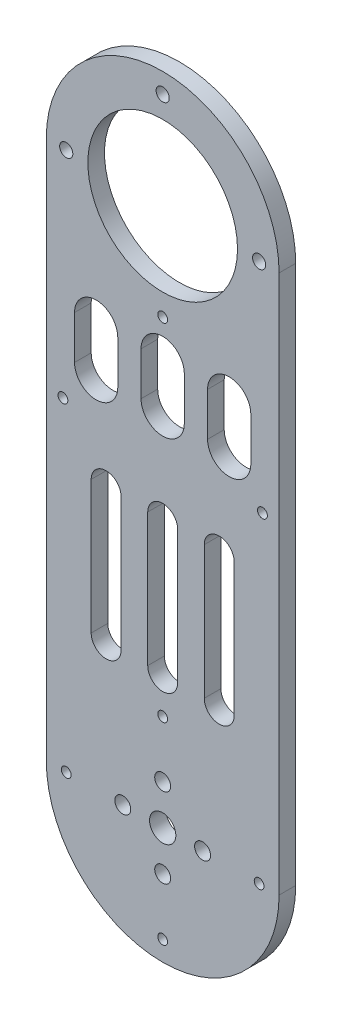
from build123d import *

# Parameters (mm, degrees)
SKETCH1_R           = 3.95
SKETCH1_R_2         = 1.475
SKETCH1_R_3         = 22.5
SKETCH1_R_4         = 2.4
SKETCH1_R_5         = 1.975
BOSS_EXTRUDE1_DEPTH = 5


with BuildPart() as part:
    # Sketch1 → Boss-Extrude1 (new body)
    with BuildSketch(Plane.XY):
        with BuildLine():
            Line((35, 0), (35, 162))
            ThreePointArc((35, 162), (0, 197), (-35, 162))
            Line((-35, 162), (-35, 0))
            ThreePointArc((-35, 0), (0, -35), (35, 0))
        make_face()
        Circle(SKETCH1_R, mode=Mode.SUBTRACT)
        with Locations((0, 29)):
            Circle(SKETCH1_R_2, mode=Mode.SUBTRACT)
        with Locations((0, 162)):
            Circle(SKETCH1_R_3, mode=Mode.SUBTRACT)
        with Locations((0, 133)):
            Circle(SKETCH1_R_2, mode=Mode.SUBTRACT)
        with Locations((-30, 97)):
            Circle(SKETCH1_R_2, mode=Mode.SUBTRACT)
        with Locations(Location((30, 97, 0), (0, 0, 180))):
            Circle(SKETCH1_R_2, mode=Mode.SUBTRACT)
        with Locations((29, 0)):
            Circle(SKETCH1_R_2, mode=Mode.SUBTRACT)
        with Locations((0, -29)):
            Circle(SKETCH1_R_2, mode=Mode.SUBTRACT)
        with Locations((-29, 0)):
            Circle(SKETCH1_R_2, mode=Mode.SUBTRACT)
        with Locations((0, 12)):
            Circle(SKETCH1_R_4, mode=Mode.SUBTRACT)
        with Locations((12, 0)):
            Circle(SKETCH1_R_4, mode=Mode.SUBTRACT)
        with Locations((0, -12)):
            Circle(SKETCH1_R_4, mode=Mode.SUBTRACT)
        with Locations((-12, 0)):
            Circle(SKETCH1_R_4, mode=Mode.SUBTRACT)
        with Locations((0, 191)):
            Circle(SKETCH1_R_5, mode=Mode.SUBTRACT)
        with Locations((29, 162)):
            Circle(SKETCH1_R_5, mode=Mode.SUBTRACT)
        with Locations((-29, 162)):
            Circle(SKETCH1_R_5, mode=Mode.SUBTRACT)
        with BuildLine():
            Line((4.5, 80), (4.5, 40))
            ThreePointArc((4.5, 40), (0, 35.5), (-4.5, 40))
            Line((-4.5, 40), (-4.5, 80))
            ThreePointArc((-4.5, 80), (0, 84.5), (4.5, 80))
        make_face(mode=Mode.SUBTRACT)
        with BuildLine():
            Line((21.5, 80), (21.5, 40))
            ThreePointArc((21.5, 40), (17, 35.5), (12.5, 40))
            Line((12.5, 40), (12.5, 80))
            ThreePointArc((12.5, 80), (17, 84.5), (21.5, 80))
        make_face(mode=Mode.SUBTRACT)
        with BuildLine():
            Line((-21.5, 80), (-21.5, 40))
            ThreePointArc((-21.5, 40), (-17, 35.5), (-12.5, 40))
            Line((-12.5, 40), (-12.5, 80))
            ThreePointArc((-12.5, 80), (-17, 84.5), (-21.5, 80))
        make_face(mode=Mode.SUBTRACT)
        with BuildLine():
            Line((6.5, 121.5), (6.5, 108.5))
            ThreePointArc((6.5, 108.5), (0, 102), (-6.5, 108.5))
            Line((-6.5, 108.5), (-6.5, 121.5))
            ThreePointArc((-6.5, 121.5), (0, 128), (6.5, 121.5))
        make_face(mode=Mode.SUBTRACT)
        with BuildLine():
            Line((26.5, 120.946496324), (26.5, 107.946496324))
            ThreePointArc((26.5, 107.946496324), (20, 101.446496324), (13.5, 107.946496324))
            Line((13.5, 107.946496324), (13.5, 120.946496324))
            ThreePointArc((13.5, 120.946496324), (20, 127.446496324), (26.5, 120.946496324))
        make_face(mode=Mode.SUBTRACT)
        with BuildLine():
            Line((-26.5, 120.946496324), (-26.5, 107.946496324))
            ThreePointArc((-26.5, 107.946496324), (-20, 101.446496324), (-13.5, 107.946496324))
            Line((-13.5, 107.946496324), (-13.5, 120.946496324))
            ThreePointArc((-13.5, 120.946496324), (-20, 127.446496324), (-26.5, 120.946496324))
        make_face(mode=Mode.SUBTRACT)
    extrude(amount=BOSS_EXTRUDE1_DEPTH)


solid = part.part
